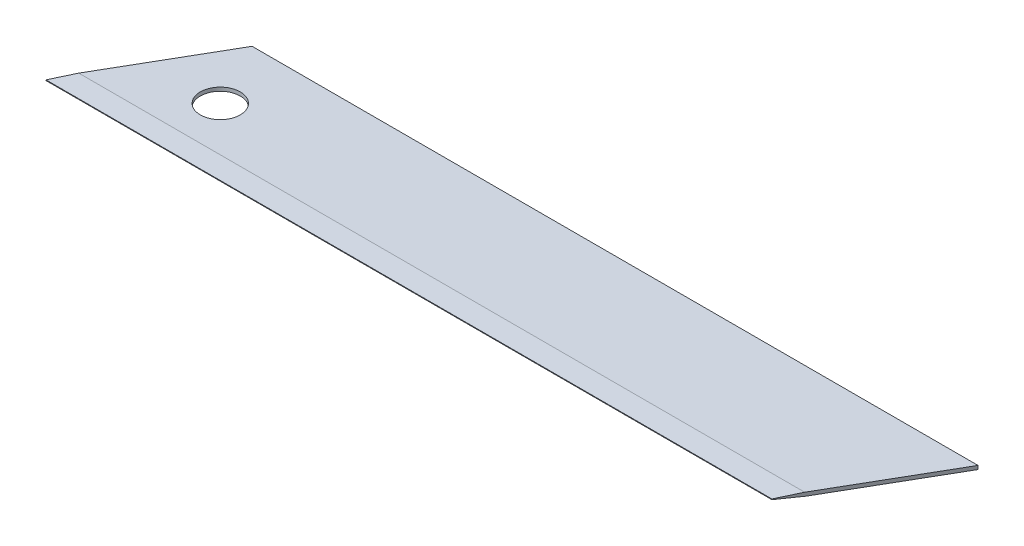
from build123d import *

# Parameters (mm, degrees)
EXTRUDE_1_DEPTH     = 0.5
SKETCH_2_R          = 2.75
CUT_EXTRUDE_1_DEPTH = 10
CHAMFER_1_SIZE      = 3
CHAMFER_1_SIZE2     = 0.209780436
CHAMFER_2_SIZE      = 0.2
CHAMFER_2_SIZE2     = 2.860133251


with BuildPart() as part:
    # 草图1 → 凸台-拉伸1 (new body)
    with BuildSketch(Plane(origin=(0, 0, 0), x_dir=(1, 0, 0), z_dir=(0, 1, 0))):
        Polygon((0, 0), (10.392304845, 18), (110.392304845, 18), (100, 0), align=None)
    extrude(amount=EXTRUDE_1_DEPTH)

    # 草图2 → 切除-拉伸1 (cut)
    with BuildSketch(Plane(origin=(0, 0, 0), x_dir=(-1, 0, 0), z_dir=(0, -1, 0))):
        with Locations(Location((-15.011106999, 9, 0), (0, 0, 90))):
            Circle(SKETCH_2_R)
    extrude(amount=-CUT_EXTRUDE_1_DEPTH, mode=Mode.SUBTRACT)

    # 倒角1
    chamfer_1_edges = [part.edges().sort_by_distance(p)[0] for p in [
        (50, 0, 0),
    ]]
    chamfer_1_side = [part.faces().sort_by_distance(p)[0] for p in [
        (55.733651423, 0, -9),
    ]]
    chamfer(chamfer_1_edges, length=CHAMFER_1_SIZE, length2=CHAMFER_1_SIZE2, reference=chamfer_1_side[0])

    # 倒角2
    chamfer_2_edges = [part.edges().sort_by_distance(p)[0] for p in [
        (50, 0.5, 0),
    ]]
    chamfer_2_side = [part.faces().sort_by_distance(p)[0] for p in [
        (50, 0.354890218, 0),
    ]]
    chamfer(chamfer_2_edges, length=CHAMFER_2_SIZE, length2=CHAMFER_2_SIZE2, reference=chamfer_2_side[0])


solid = part.part
